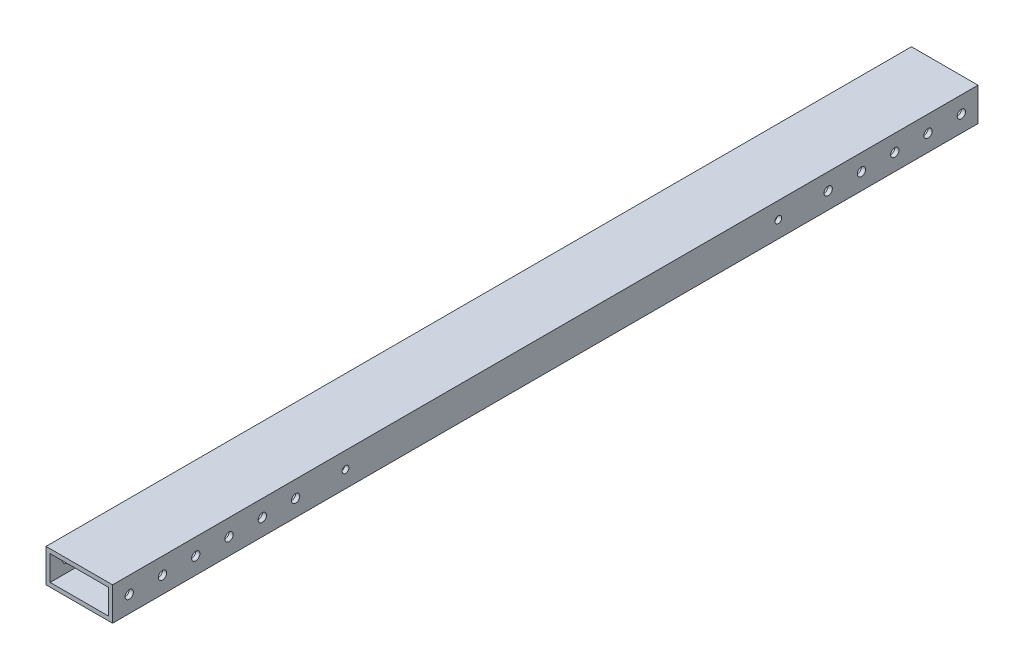
from build123d import *

# Parameters (mm, degrees)
BOSS_EXTRUDE1_DEPTH              = 330.2
BOSS_EXTRUDE1_DEPTH_BACK         = 330.2
SKETCH3_W                        = 50.8
SKETCH3_H                        = 25.4
SKETCH3_W_2                      = 44.45
SKETCH3_H_2                      = 19.05
F_1_4_0_25_DIAMETER_HOLE3_D      = 6.35
F_1_4_0_25_DIAMETER_HOLE4_D      = 6.35
F_1_4_0_25_DIAMETER_HOLE5_D      = 6.35
F_1_4_0_25_DIAMETER_HOLE6_D      = 6.35
F_1_4_0_25_DIAMETER_HOLE7_D      = 6.35
F_1_4_0_25_DIAMETER_HOLE8_D      = 6.35
F_13_64_0_20313_DIAMETER_HOLE1_D = 5.159502
F_1_2_0_5_DIAMETER_HOLE1_D       = 12.7
F_1_2_0_5_DIAMETER_HOLE1_DEPTH   = 6.35
F_1_2_0_5_DIAMETER_HOLE1_TIP     = 3.815464931


with BuildPart() as part:
    # Sketch3 → Boss-Extrude1 (new, two sides: drawn at the far end of the back side and taken through both)
    with BuildSketch(Plane.XY.offset(-BOSS_EXTRUDE1_DEPTH_BACK)):
        Rectangle(SKETCH3_W, SKETCH3_H)
        Rectangle(SKETCH3_W_2, SKETCH3_H_2, mode=Mode.SUBTRACT)
    extrude(amount=BOSS_EXTRUDE1_DEPTH + BOSS_EXTRUDE1_DEPTH_BACK)

    # 1/4 (0.25) Diameter Hole3 (through all)
    with Locations(Plane.ZY.offset(25.4)):
        with Locations((-317.5, 0)):
            Hole(F_1_4_0_25_DIAMETER_HOLE3_D / 2)

    # 1/4 (0.25) Diameter Hole4 (through all)
    with Locations(Plane.ZY.offset(25.4)):
        with Locations((292.1, 0), (317.5, 0)):
            Hole(F_1_4_0_25_DIAMETER_HOLE4_D / 2)

    # 1/4 (0.25) Diameter Hole5 (through all)
    with Locations(Plane(origin=(25.4, 0, 0), x_dir=(0, 0, -1), z_dir=(1, 0, 0))):
        with Locations((292.1, 0), (266.7, 0)):
            Hole(F_1_4_0_25_DIAMETER_HOLE5_D / 2)

    # 1/4 (0.25) Diameter Hole6 (through all)
    with Locations(Plane(origin=(25.4, 0, 0), x_dir=(0, 0, -1), z_dir=(1, 0, 0))):
        with Locations((215.9, 0), (241.3, 0)):
            Hole(F_1_4_0_25_DIAMETER_HOLE6_D / 2)

    # 1/4 (0.25) Diameter Hole7 (through all)
    with Locations(Plane(origin=(25.4, 0, 0), x_dir=(0, 0, -1), z_dir=(1, 0, 0))):
        with Locations((-190.5, 0), (-215.9, 0)):
            Hole(F_1_4_0_25_DIAMETER_HOLE7_D / 2)

    # 1/4 (0.25) Diameter Hole8 (through all)
    with Locations(Plane(origin=(25.4, 0, 0), x_dir=(0, 0, -1), z_dir=(1, 0, 0))):
        with Locations((-266.7, 0), (-241.3, 0)):
            Hole(F_1_4_0_25_DIAMETER_HOLE8_D / 2)

    # 13/64 (0.20313) Diameter Hole1 (through all)
    with Locations(Plane(origin=(25.4, 0, 0), x_dir=(0, 0, -1), z_dir=(1, 0, 0))):
        with Locations((-152.4, 0), (177.8, 0)):
            Hole(F_13_64_0_20313_DIAMETER_HOLE1_D / 2)

    # 1/2 (0.5) Diameter Hole1
    with Locations(Plane.ZY.offset(25.4)):
        with Locations((-146.050000508, 4.9e-08), (120.65, 1.7e-08), (101.600001492, 7.77e-07), (76.200001492, 7.03e-07)):
            Hole(F_1_2_0_5_DIAMETER_HOLE1_D / 2, depth=F_1_2_0_5_DIAMETER_HOLE1_DEPTH)
            with Locations((0, 0, -(F_1_2_0_5_DIAMETER_HOLE1_DEPTH + F_1_2_0_5_DIAMETER_HOLE1_TIP / 2))):  # 118° drill point
                Cone(0, F_1_2_0_5_DIAMETER_HOLE1_D / 2, F_1_2_0_5_DIAMETER_HOLE1_TIP, mode=Mode.SUBTRACT)


solid = part.part
